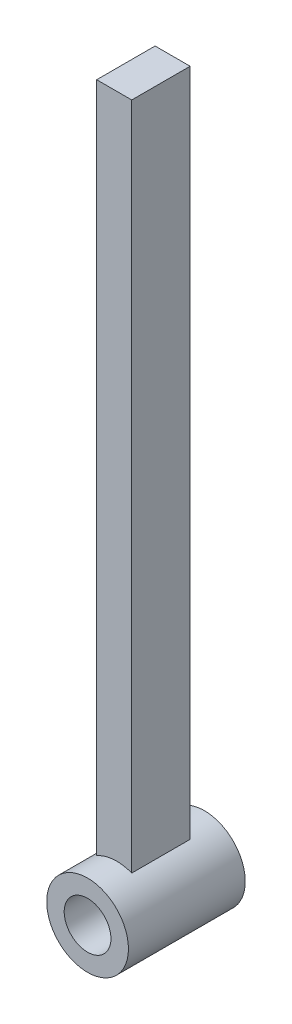
from build123d import *

# Parameters (mm, degrees)
ESQUISSE1_W             = 3
ESQUISSE1_H             = 55
BOSS_EXTRU_1_DEPTH      = 2.5
ESQUISSE2_R             = 3.5
ESQUISSE2_R_2           = 2
BOSS_EXTRU_2_DEPTH      = 5
BOSS_EXTRU_3_REACH      = 57.473
BOSS_EXTRU_3_END_RADIUS = 2
ESQUISSE3_W             = 3
ESQUISSE3_H             = 5


with BuildPart() as part:
    # Esquisse1 → Boss.-Extru.1 (new, symmetric)
    with BuildSketch(Plane.XY):
        with Locations((1.5, 27.5)):
            Rectangle(ESQUISSE1_W, ESQUISSE1_H)
    extrude(amount=BOSS_EXTRU_1_DEPTH, both=True)



with BuildPart() as body_2:
    # Esquisse2 → Boss.-Extru.2 (new, symmetric)
    with BuildSketch(Plane.XY):
        with Locations((1.718667593, -5.582160954)):
            Circle(ESQUISSE2_R)
        with Locations((1.718667593, -5.582160954)):
            Circle(ESQUISSE2_R_2, mode=Mode.SUBTRACT)
    extrude(amount=BOSS_EXTRU_2_DEPTH, both=True)


with BuildPart() as part_1:
    add(part.part)

    add(body_2.part)  # Boss.-Extru.3 merges body 2
    # Boss.-Extru.3: up to this cylinder (the profile starts outside it)
    boss_extru_3_end = Plane(origin=(1.718667593, -5.582160954, 0), z_dir=(0, 0, -1)) * Cylinder(BOSS_EXTRU_3_END_RADIUS, 119.946, mode=Mode.PRIVATE)
    # Esquisse3 → Boss.-Extru.3 (add, up to the surface)
    with BuildSketch(Plane.XZ, mode=Mode.PRIVATE) as boss_extru_3_sk1:
        with Locations((1.5, 0)):
            Rectangle(ESQUISSE3_W, ESQUISSE3_H)
    boss_extru_3_tool1 = extrude(boss_extru_3_sk1.sketch, amount=BOSS_EXTRU_3_REACH, mode=Mode.PRIVATE) - boss_extru_3_end
    add(boss_extru_3_tool1.solids().sort_by_distance((1.5, 0, 0))[0])


solid = part_1.part
